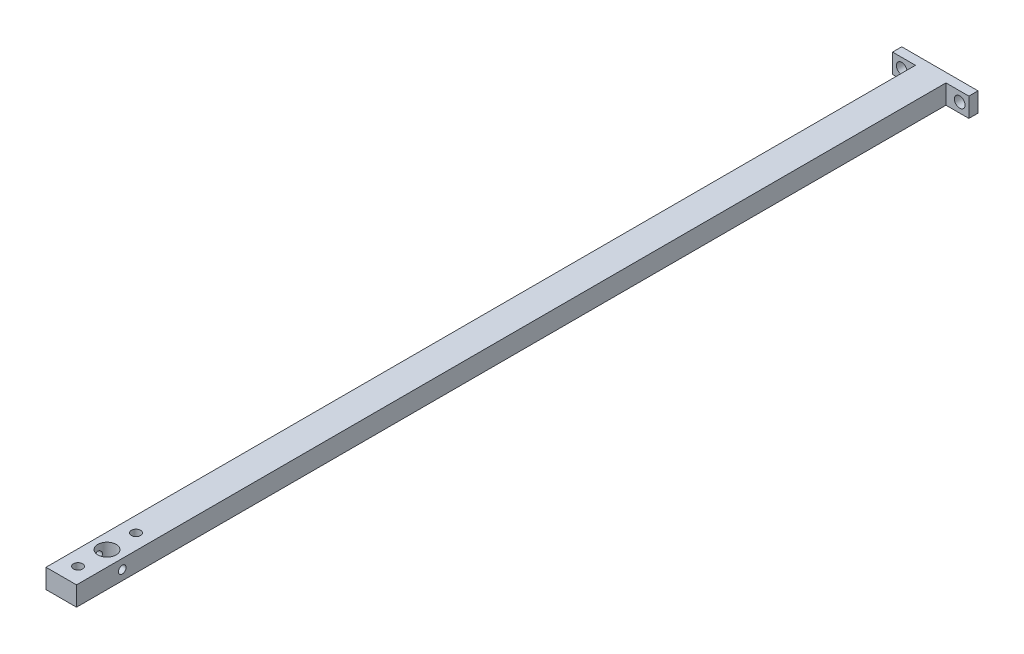
from build123d import *

# Parameters (mm, degrees)
BOSS_EXTRUDE1_DEPTH         = 3.175
BOSS_EXTRUDE1_DEPTH_BACK    = 3.175
SKETCH1_R                   = 1.5
SKETCH1_R_2                 = 3
SKETCH2_R                   = 1.75
CUT_EXTRUDE1_DEPTH          = 3
TAP_DRILL_FOR_M3X0_5_TAP1_D = 2.5


with BuildPart() as part:
    # Sketch1 → Boss-Extrude1 (new, two sides: drawn at the far end of the back side and taken through both)
    with BuildSketch(Plane(origin=(0, 0, 0), x_dir=(1, 0, 0), z_dir=(0, 1, 0)).offset(-BOSS_EXTRUDE1_DEPTH_BACK)):
        Polygon((-5, 270), (-5, -15), (5, -15), (5, 270), (12.5, 270), (12.5, 273), (-12.5, 273), (-12.5, 270), align=None)
        with Locations((0, -9.5)):
            Circle(SKETCH1_R, mode=Mode.SUBTRACT)
        with Locations((0, 9.5)):
            Circle(SKETCH1_R, mode=Mode.SUBTRACT)
        Circle(SKETCH1_R_2, mode=Mode.SUBTRACT)
    extrude(amount=BOSS_EXTRUDE1_DEPTH + BOSS_EXTRUDE1_DEPTH_BACK)

    # Sketch2 → Cut-Extrude1 (cut)
    with BuildSketch(Plane(origin=(0, 0, -273), x_dir=(-1, 0, 0), z_dir=(0, 0, -1))):
        with Locations((-9.5, 0)):
            Circle(SKETCH2_R)
        with Locations((9.5, 0)):
            Circle(SKETCH2_R)
    extrude(amount=-CUT_EXTRUDE1_DEPTH, mode=Mode.SUBTRACT)

    # Tap Drill for M3x0.5 Tap1 (through all)
    with Locations(Plane(origin=(5, 0, 0), x_dir=(0, 0, -1), z_dir=(1, 0, 0))):
        with Locations((0, 0)):
            Hole(TAP_DRILL_FOR_M3X0_5_TAP1_D / 2)


solid = part.part
